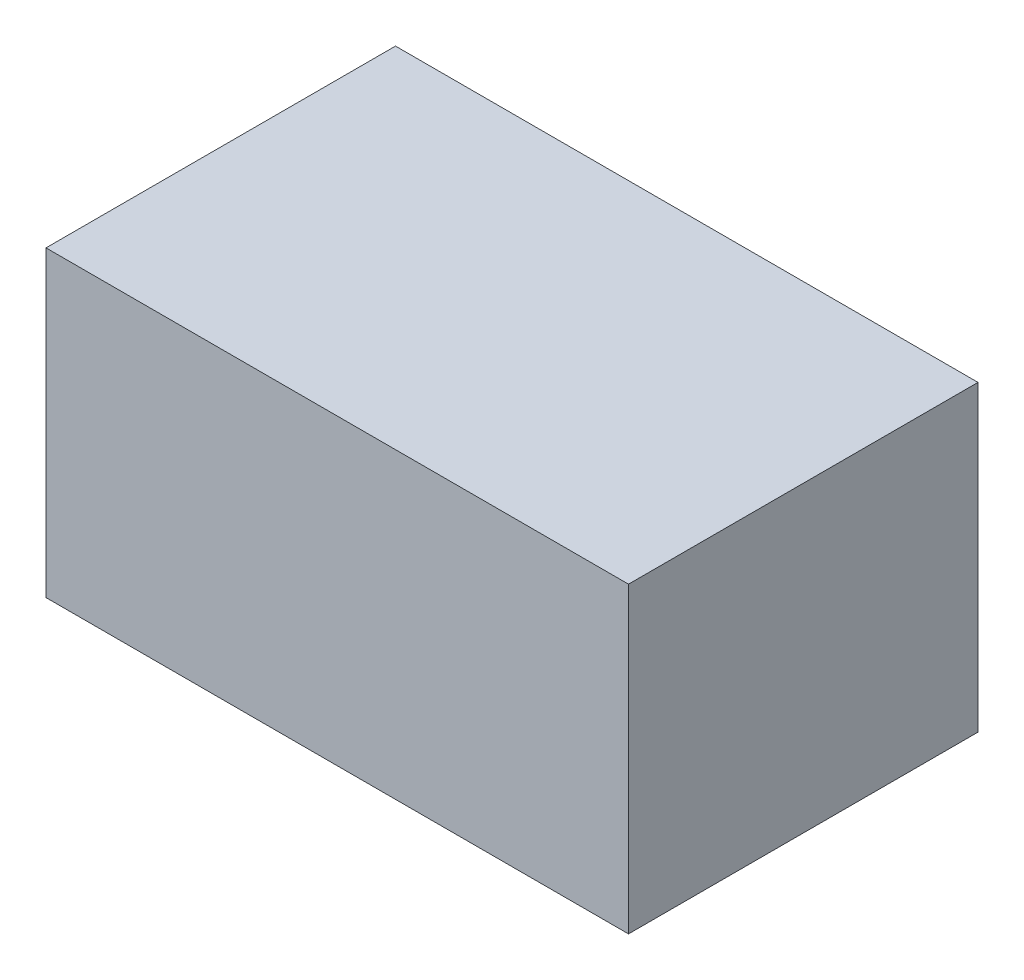
from build123d import *

# Parameters (mm, degrees)
CROQUIS1_W              = 250
CROQUIS1_H              = 150
SALIENTE_EXTRUIR1_DEPTH = 130


with BuildPart() as part:
    # Croquis1 → Saliente-Extruir1 (new body)
    with BuildSketch(Plane(origin=(0, 0, 0), x_dir=(1, 0, 0), z_dir=(0, 1, 0))):
        Rectangle(CROQUIS1_W, CROQUIS1_H)
    extrude(amount=SALIENTE_EXTRUIR1_DEPTH)


solid = part.part
